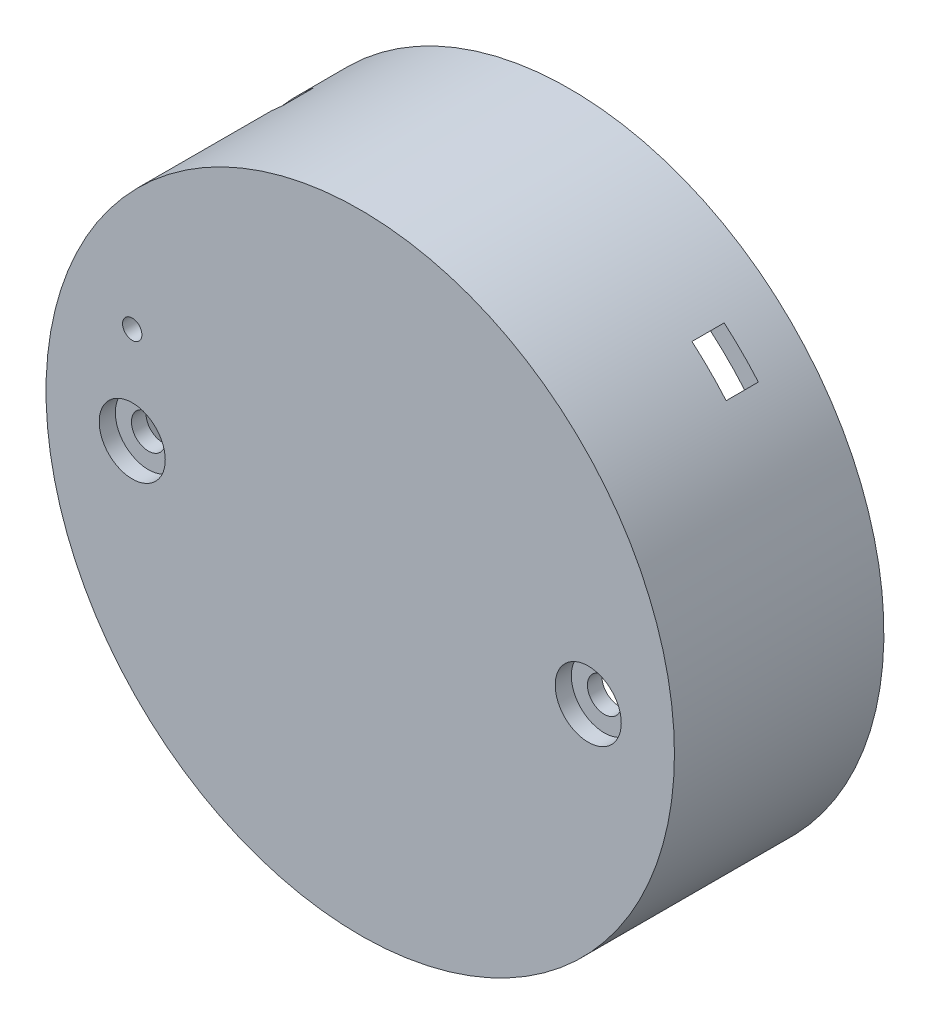
from build123d import *

# Parameters (mm, degrees)
SKETCH_2_R          = 19.5
EXTRUDE_1_DEPTH     = 13
CUT_EXTRUDE_1_DEPTH = 1.5
SKETCH_4_R          = 18.3
CUT_EXTRUDE_2_DEPTH = 11.1
SKETCH_5_R          = 1.05
SKETCH_5_R_2        = 0.6
CUT_EXTRUDE_3_DEPTH = 41.284008974
SKETCH_6_R          = 2.05
CUT_EXTRUDE_4_DEPTH = 1
SKETCH_8_W          = 8.75
SKETCH_8_H          = 7.3
CUT_EXTRUDE_5_DEPTH = 3.25
CUT_EXTRUDE_6_DEPTH = 2


with BuildPart() as part:
    # 草图2 → 凸台-拉伸1 (new body)
    with BuildSketch(Plane.XY):
        with Locations(Location((5.210280057, 9.537965238, 0), (0, 0, 180))):
            Circle(SKETCH_2_R)
    extrude(amount=EXTRUDE_1_DEPTH)

    # 草图3 → 切除-拉伸1 (cut)
    with BuildSketch(Plane.XY):
        with BuildLine():
            ThreePointArc((-2.089466108, -9.474373158), (5.210280057, -10.827576871), (12.510026223, -9.474373158))
            add(Edge.make_bspline(
                [(12.510026223, -9.474373158), (12.542948952, -8.674555972), (12.802081824, -7.965268064), (13.798852187, -6.666991519), (14.542722505, -6.079743438), (15.544339227, -5.564922601)],
                knots=[0, 0, 0, 0, 0.5, 0.5, 1, 1, 1, 1], degree=3))
            ThreePointArc((15.544339227, -5.564922601), (5.210280058, 27.837965238), (-5.123779113, -5.564922601))
            add(Edge.make_bspline(
                [(-5.123779113, -5.564922601), (-4.122162391, -6.079743437), (-3.378292072, -6.666991518), (-2.381521709, -7.965268064), (-2.122388837, -8.674555972), (-2.089466108, -9.474373158)],
                knots=[0, 0, 0, 0, 0.5, 0.5, 1, 1, 1, 1], degree=3))
        make_face()
    extrude(amount=CUT_EXTRUDE_1_DEPTH, mode=Mode.SUBTRACT)

    # 草图4 → 切除-拉伸2 (cut)
    with BuildSketch(Plane.XY):
        with Locations(Location((5.210280057, 9.537965238, 0), (0, 0, 240.328288749))):
            Circle(SKETCH_4_R)
    extrude(amount=CUT_EXTRUDE_2_DEPTH, mode=Mode.SUBTRACT)

    # 草图5 → 切除-拉伸3 (cut, through all)
    with BuildSketch(Plane.XY):
        with Locations(Location((19.360280057, 9.537965238, 0), (0, 0, 180))):
            Circle(SKETCH_5_R)
        with Locations(Location((-8.939719943, 9.537965238, 0), (0, 0, 180))):
            Circle(SKETCH_5_R)
        with Locations((-8.939719943, 15.537965238)):
            Circle(SKETCH_5_R_2)
    extrude(amount=CUT_EXTRUDE_3_DEPTH, mode=Mode.SUBTRACT)

    # 草图6 → 切除-拉伸4 (cut)
    with BuildSketch(Plane.XY.offset(13)):
        with Locations((-8.939719943, 9.537965238)):
            Circle(SKETCH_6_R)
        with Locations((19.360280057, 9.537965238)):
            Circle(SKETCH_6_R)
    extrude(amount=-CUT_EXTRUDE_4_DEPTH, mode=Mode.SUBTRACT)

    # 草图8 → 切除-拉伸5 (cut)
    with BuildSketch(Plane(origin=(0, 0, 3.1), x_dir=(-1, 0, 0), z_dir=(0, 0, -1))):
        with Locations((-5.210300293, -6.312034762)):
            Rectangle(SKETCH_8_W, SKETCH_8_H)
    extrude(amount=-CUT_EXTRUDE_5_DEPTH, mode=Mode.SUBTRACT)

    # 草图9 → 切除-拉伸6 (cut)
    with BuildSketch(Plane(origin=(0, 0, 3.1), x_dir=(-1, 0, 0), z_dir=(0, 0, -1))):
        with BuildLine():
            ThreePointArc((-20.059522462, 24.387207643), (-20.580706206, 23.847053259), (-21.082253473, 23.28861831))
            Line((-21.082253473, 23.28861831), (-18.998862291, 21.205227127))
            Line((-18.998862291, 21.205227127), (-17.938202119, 22.265887299))
            Line((-17.938202119, 22.265887299), (-16.877541947, 23.326547471))
            Line((-16.877541947, 23.326547471), (-18.960933129, 25.409938653))
            ThreePointArc((-18.960933129, 25.409938653), (-19.519368079, 24.908391387), (-20.059522462, 24.387207643))
        make_face()
        with BuildLine():
            Line((8.578302176, 21.205227127), (10.661693358, 23.28861831))
            ThreePointArc((10.661693358, 23.28861831), (10.160146112, 23.847053237), (9.638962389, 24.387207601))
            ThreePointArc((9.638962389, 24.387207601), (9.098807986, 24.908391366), (8.540373014, 25.409938653))
            Line((8.540373014, 25.409938653), (6.456981832, 23.326547471))
            Line((6.456981832, 23.326547471), (7.517642025, 22.265887278))
            Line((7.517642025, 22.265887278), (8.578302176, 21.205227127))
        make_face()
    extrude(amount=-CUT_EXTRUDE_6_DEPTH, mode=Mode.SUBTRACT)


solid = part.part
